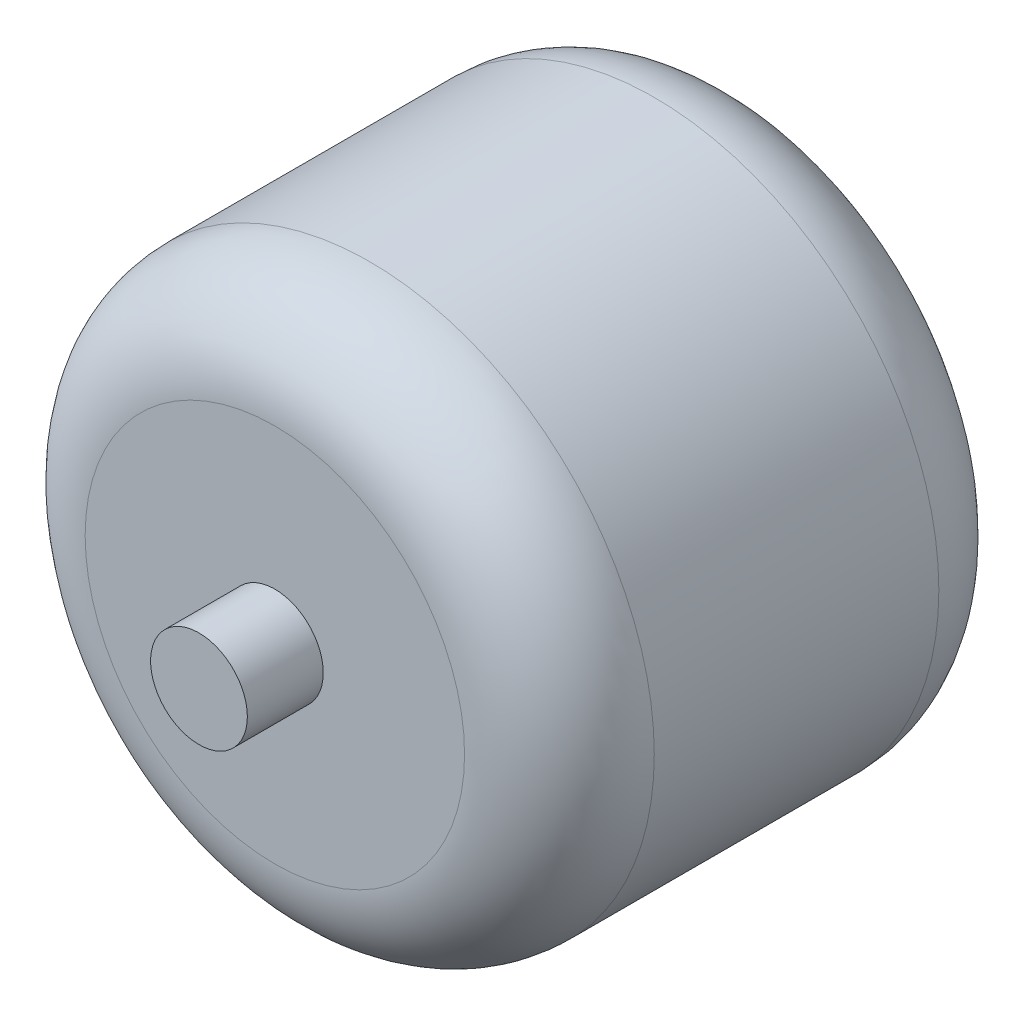
from build123d import *

# Parameters (mm, degrees)
CROQUIS1_R              = 15
SALIENTE_EXTRUIR1_DEPTH = 25
REDONDEO2_R             = 5
CROQUIS2_R              = 2.55
SALIENTE_EXTRUIR2_DEPTH = 4


with BuildPart() as part:
    # Croquis1 → Saliente-Extruir1 (new body)
    with BuildSketch(Plane.XY):
        Circle(CROQUIS1_R)
    extrude(amount=SALIENTE_EXTRUIR1_DEPTH)

    # Redondeo2
    redondeo2_edges = [part.edges().sort_by_distance(p)[0] for p in [
        (-15, 0, 0),
        (-15, 0, 25),
    ]]
    fillet(redondeo2_edges, radius=REDONDEO2_R)

    # Croquis2 → Saliente-Extruir2 (add)
    with BuildSketch(Plane.XY.offset(25)):
        Circle(CROQUIS2_R)
    extrude(amount=SALIENTE_EXTRUIR2_DEPTH)


solid = part.part
